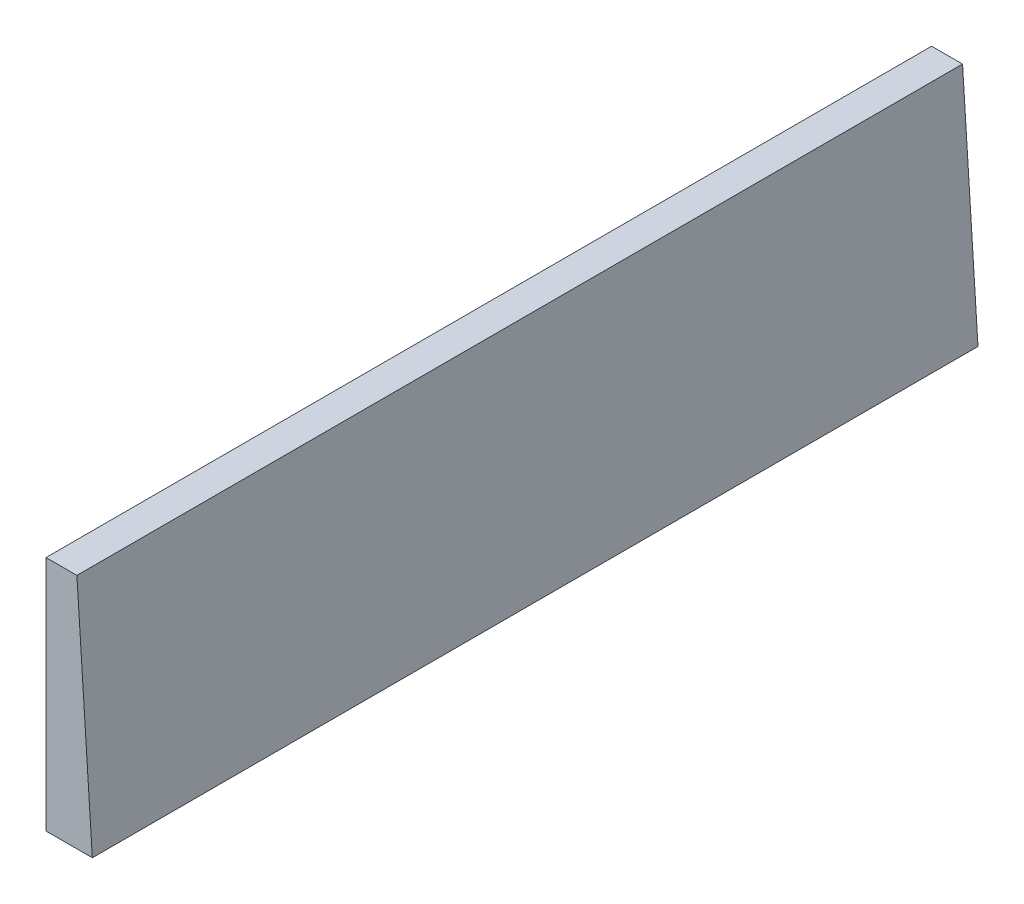
from build123d import *

# Parameters (mm, degrees)
BOSS_EXTRUDE1_DEPTH      = 4300
BOSS_EXTRUDE1_DEPTH_BACK = 4300


with BuildPart() as part:
    # Sketch1 → Boss-Extrude1 (new, two sides: drawn at the far end of the back side and taken through both)
    with BuildSketch(Plane.XY.offset(-BOSS_EXTRUDE1_DEPTH_BACK)):
        Polygon((0, 0), (0, 1150), (300, 1150), (450, -1150), (0, -1150), align=None)
    extrude(amount=BOSS_EXTRUDE1_DEPTH + BOSS_EXTRUDE1_DEPTH_BACK)


solid = part.part
